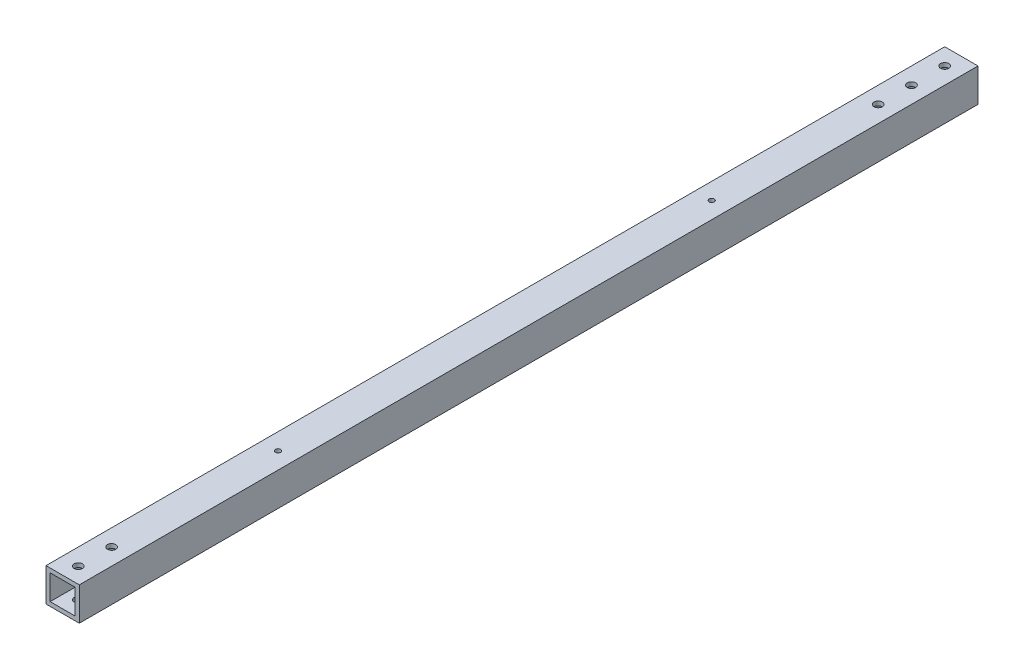
from build123d import *

# Parameters (mm, degrees)
BOSS_EXTRUDE1_DEPTH             = 342.9
BOSS_EXTRUDE1_DEPTH_BACK        = 342.9
SKETCH3_W                       = 25.4
SKETCH3_H                       = 25.4
SKETCH3_W_2                     = 19.05
SKETCH3_H_2                     = 19.05
F_5_32_0_15625_DIAMETER_HOLE1_D = 3.96875
F_1_4_0_25_DIAMETER_HOLE1_D     = 6.35
F_1_4_0_25_DIAMETER_HOLE2_D     = 6.35


with BuildPart() as part:
    # Sketch3 → Boss-Extrude1 (new, two sides: drawn at the far end of the back side and taken through both)
    with BuildSketch(Plane.XY.offset(-BOSS_EXTRUDE1_DEPTH_BACK)):
        Rectangle(SKETCH3_W, SKETCH3_H)
        Rectangle(SKETCH3_W_2, SKETCH3_H_2, mode=Mode.SUBTRACT)
    extrude(amount=BOSS_EXTRUDE1_DEPTH + BOSS_EXTRUDE1_DEPTH_BACK)

    # 5/32 (0.15625) Diameter Hole1 (through all)
    with Locations(Plane(origin=(0, 12.7, 0), x_dir=(1, 0, 0), z_dir=(0, 1, 0))):
        with Locations((0, 152.4), (0, -178.5118096)):
            Hole(F_5_32_0_15625_DIAMETER_HOLE1_D / 2)

    # 1/4 (0.25) Diameter Hole1 (through all)
    with Locations(Plane(origin=(0, 12.7, 0), x_dir=(1, 0, 0), z_dir=(0, 1, 0))):
        with Locations((0, 330.2), (0, 304.8), (0, 279.4)):
            Hole(F_1_4_0_25_DIAMETER_HOLE1_D / 2)

    # 1/4 (0.25) Diameter Hole2 (through all)
    with Locations(Plane(origin=(0, 12.7, 0), x_dir=(1, 0, 0), z_dir=(0, 1, 0))):
        with Locations((0, -330.911799988), (0, -305.511799988)):
            Hole(F_1_4_0_25_DIAMETER_HOLE2_D / 2)


solid = part.part
